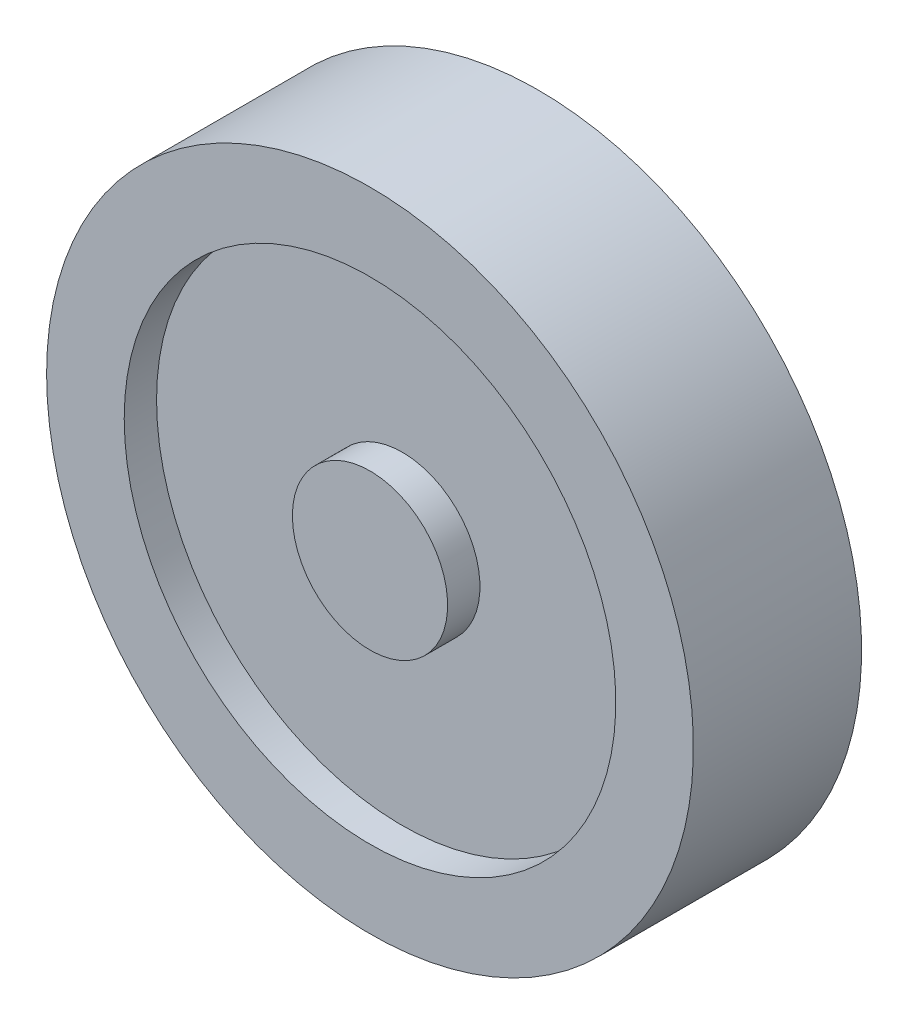
from build123d import *


with BuildPart() as part:
    # SK_Wheel → Wheel (revolve)
    with BuildSketch(Plane(origin=(0, 0, 0), x_dir=(1, 0, 0), z_dir=(0, 1, 0)), mode=Mode.PRIVATE) as wheel_sk:
        Polygon((0, 13), (12, 13), (12, 8), (38, 8), (38, 13), (50, 13), (50, -13), (38, -13), (38, -8), (12, -8), (12, -13), (0, -13), align=None)
    revolve(wheel_sk.sketch.rotate(Axis((0, 0, -18), (0, 0, 1)), 180), axis=Axis((0, 0, -18), (0, 0, 1)))


solid = part.part
